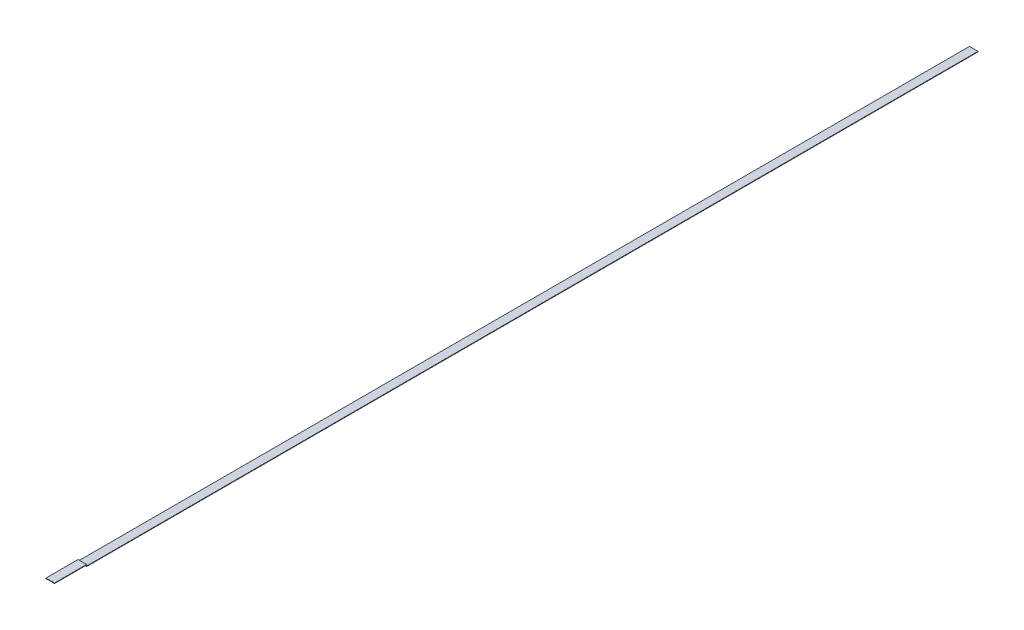
from build123d import *

# Parameters (mm, degrees)
SKETCH1_W           = 50.8
SKETCH1_H           = 5295.9
BOSS_EXTRUDE1_DEPTH = 3.175
SKETCH2_W           = 50.8
SKETCH2_H           = 190.5
BOSS_EXTRUDE2_DEPTH = 3.175


with BuildPart() as part:
    # Sketch1 → Boss-Extrude1 (new body)
    with BuildSketch(Plane(origin=(0, 0, 0), x_dir=(1, 0, 0), z_dir=(0, 1, 0))):
        with Locations((25.4, 2838.45)):
            Rectangle(SKETCH1_W, SKETCH1_H)
    extrude(amount=BOSS_EXTRUDE1_DEPTH)


with BuildPart() as body_2:
    # Sketch2 → Boss-Extrude2 (new body)
    with BuildSketch(Plane(origin=(0, 7.9375, 0), x_dir=(1, 0, 0), z_dir=(0, 1, 0))):
        with Locations((25.4, 95.25)):
            Rectangle(SKETCH2_W, SKETCH2_H)
    extrude(amount=BOSS_EXTRUDE2_DEPTH)


solid = Compound([part.part, body_2.part])
